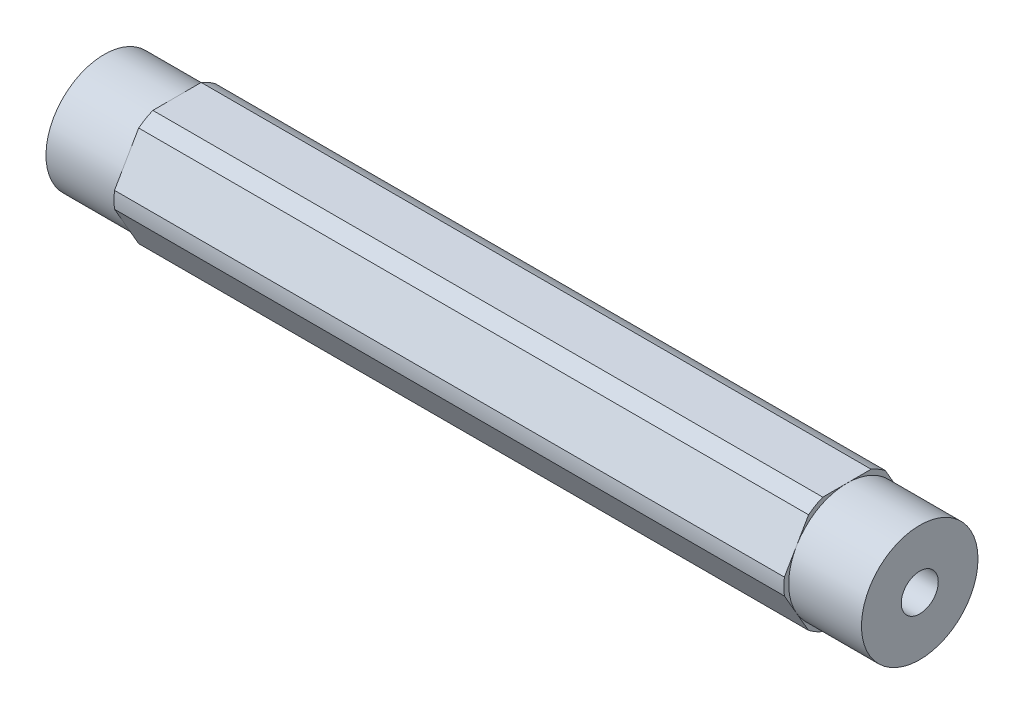
from build123d import *

# Parameters (mm, degrees)
SKETCH1_R               = 2.0193
BOSS_EXTRUDE1_DEPTH     = 44.45
SKETCH2_R               = 8.89
SKETCH2_R_2             = 6.35
CUT_EXTRUDE_THIN1_DEPTH = 7.9375


with BuildPart() as part:
    # Sketch1 → Boss-Extrude1 (new, symmetric)
    with BuildSketch(Plane(origin=(0, 0, 0), x_dir=(0, 0, -1), z_dir=(1, 0, 0))):
        with BuildLine():
            ThreePointArc((6.874999966, 0), (6.860422465, 0.447468582), (6.816751782, 0.893039571))
            Line((6.816751782, 0.893039571), (4.181770846, 5.456960429))
            ThreePointArc((4.181770846, 5.456960429), (3.437499983, 5.953924622), (2.634980936, 6.35))
            Line((2.634980936, 6.35), (-2.634980936, 6.35))
            ThreePointArc((-2.634980936, 6.35), (-3.437499983, 5.953924622), (-4.181770846, 5.456960429))
            Line((-4.181770846, 5.456960429), (-6.816751782, 0.893039571))
            ThreePointArc((-6.816751782, 0.893039571), (-6.874999966, 0), (-6.816751782, -0.893039571))
            Line((-6.816751782, -0.893039571), (-4.181770846, -5.456960429))
            ThreePointArc((-4.181770846, -5.456960429), (-3.437499983, -5.953924622), (-2.634980936, -6.35))
            Line((-2.634980936, -6.35), (2.634980936, -6.35))
            ThreePointArc((2.634980936, -6.35), (3.437499983, -5.953924622), (4.181770846, -5.456960429))
            Line((4.181770846, -5.456960429), (6.816751782, -0.893039571))
            ThreePointArc((6.816751782, -0.893039571), (6.860422465, -0.447468582), (6.874999966, 0))
        make_face()
        Circle(SKETCH1_R, mode=Mode.SUBTRACT)
    extrude(amount=BOSS_EXTRUDE1_DEPTH, both=True)

    # Sketch2 → Cut-Extrude-Thin1 (cut)
    with BuildSketch(Plane(origin=(44.45, 0, 0), x_dir=(0, 0, -1), z_dir=(1, 0, 0))):
        Circle(SKETCH2_R)
        Circle(SKETCH2_R_2, mode=Mode.SUBTRACT)
    cut_extrude_thin1 = extrude(amount=-CUT_EXTRUDE_THIN1_DEPTH, mode=Mode.SUBTRACT)

    # Mirror1: Cut-Extrude-Thin1 across plane
    add(cut_extrude_thin1.mirror(Plane(origin=(0, 0, 0), x_dir=(0, 0, 1), z_dir=(1, 0, 0))), mode=Mode.SUBTRACT)


solid = part.part
